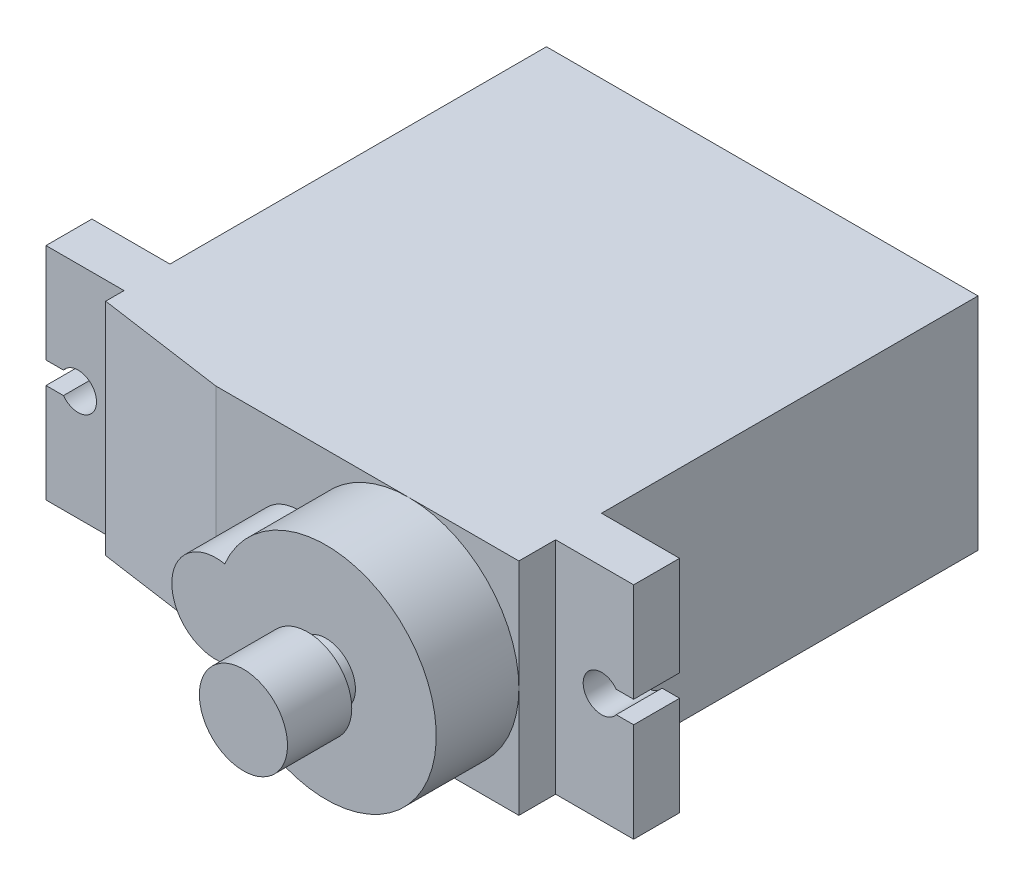
from build123d import *

# Parameters (mm, degrees)
SKETCH1_R           = 6
BOSS_EXTRUDE1_DEPTH = 6.5
SKETCH2_W           = 23.5
SKETCH2_H           = 12
BOSS_EXTRUDE2_DEPTH = 2
BOSS_EXTRUDE3_DEPTH = 2.5
SKETCH4_W           = 23.5
SKETCH4_H           = 12
BOSS_EXTRUDE4_DEPTH = 20.5
BOSS_EXTRUDE5_DEPTH = 4.5
SKETCH6_R           = 1.6
BOSS_EXTRUDE6_DEPTH = 1
SKETCH7_R           = 2.4
BOSS_EXTRUDE7_DEPTH = 3.5
CHAMFER1_SIZE       = 1
CHAMFER1_SIZE2      = 7


with BuildPart() as part:
    # Sketch1 → Boss-Extrude1 (new body)
    with BuildSketch(Plane.XY):
        with Locations(Location((0, 0, 0), (0, 0, 180))):
            Circle(SKETCH1_R)
    extrude(amount=BOSS_EXTRUDE1_DEPTH)

    # Sketch2 → Boss-Extrude2 (add)
    with BuildSketch(Plane.XY):
        with Locations((-5.75, 0)):
            Rectangle(SKETCH2_W, SKETCH2_H)
    extrude(amount=BOSS_EXTRUDE2_DEPTH)

    # Sketch3 → Boss-Extrude3 (add)
    with BuildSketch(Plane.XY):
        with BuildLine():
            Line((10.25, 6), (-21.75, 6))
            Line((-21.75, 6), (-21.75, 0.6))
            Line((-21.75, 0.6), (-20.8, 0.6))
            ThreePointArc((-20.8, 0.6), (-19, 0), (-20.8, -0.6))
            Line((-20.8, -0.6), (-21.75, -0.6))
            Line((-21.75, -0.6), (-21.75, -6))
            Line((-21.75, -6), (10.25, -6))
            Line((10.25, -6), (10.25, -0.6))
            Line((10.25, -0.6), (9.3, -0.6))
            ThreePointArc((9.3, -0.6), (7.5, 0), (9.3, 0.6))
            Line((9.3, 0.6), (10.25, 0.6))
            Line((10.25, 0.6), (10.25, 6))
        make_face()
    extrude(amount=-BOSS_EXTRUDE3_DEPTH)

    # Sketch4 → Boss-Extrude4 (add)
    with BuildSketch(Plane(origin=(0, 0, -2.5), x_dir=(-1, 0, 0), z_dir=(0, 0, -1))):
        with Locations((5.75, 0)):
            Rectangle(SKETCH4_W, SKETCH4_H)
    extrude(amount=BOSS_EXTRUDE4_DEPTH)

    # Sketch5 → Boss-Extrude5 (add)
    with BuildSketch(Plane.XY.offset(2)):
        with BuildLine():
            ThreePointArc((-5.52, -2.351510153), (-6, 0), (-5.52, 2.351510153))
            ThreePointArc((-5.52, 2.351510153), (-8.4, 0), (-5.52, -2.351510153))
        make_face()
    extrude(amount=BOSS_EXTRUDE5_DEPTH)

    # Sketch6 → Boss-Extrude6 (add)
    with BuildSketch(Plane.XY.offset(6.5)):
        Circle(SKETCH6_R)
    extrude(amount=BOSS_EXTRUDE6_DEPTH)

    # Sketch7 → Boss-Extrude7 (add)
    with BuildSketch(Plane.XY.offset(7.5)):
        Circle(SKETCH7_R)
    extrude(amount=BOSS_EXTRUDE7_DEPTH)

    # Chamfer1
    chamfer1_edges = [part.edges().sort_by_distance(p)[0] for p in [
        (-17.5, 0, 2),
    ]]
    chamfer1_side = [part.faces().sort_by_distance(p)[0] for p in [
        (-17.5, 0, 1),
    ]]
    chamfer(chamfer1_edges, length=CHAMFER1_SIZE, length2=CHAMFER1_SIZE2, reference=chamfer1_side[0])


solid = part.part
